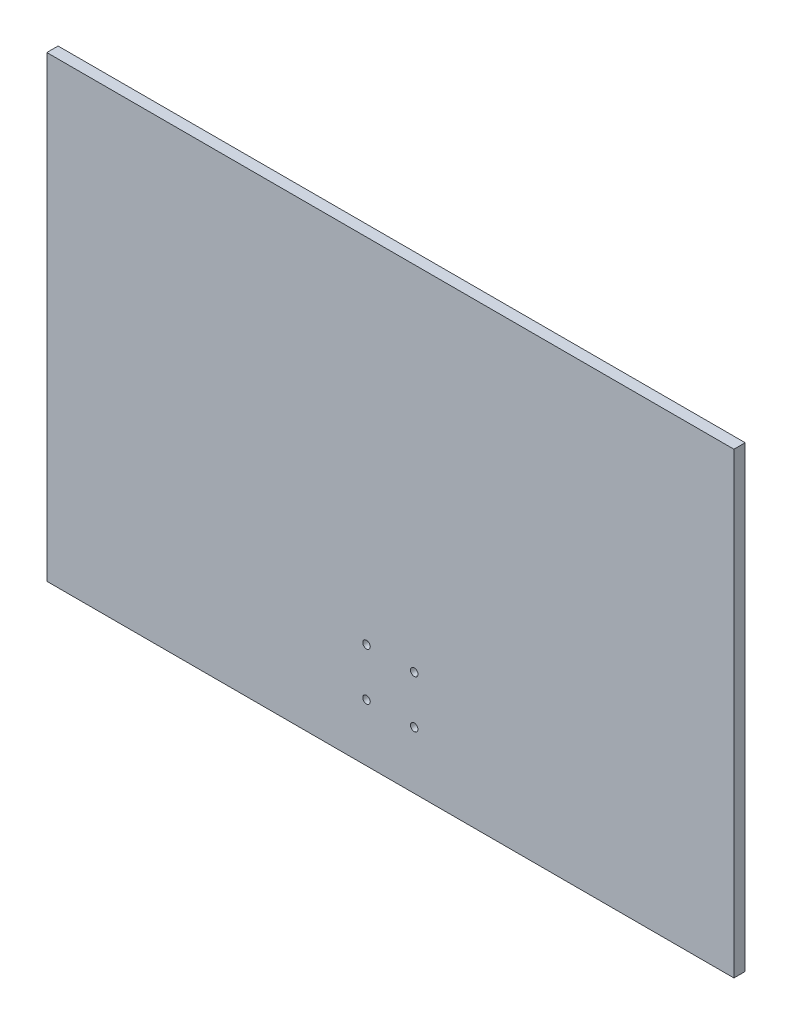
from build123d import *

# Parameters (mm, degrees)
SKETCH1_W           = 30
SKETCH1_H           = 1219
BOSS_EXTRUDE5_DEPTH = 1829
SKETCH6_R           = 10
CUT_EXTRUDE1_DEPTH  = 2199.204267124


with BuildPart() as part:
    # Sketch1 → Boss-Extrude5 (new body)
    with BuildSketch(Plane(origin=(0, 0, 0), x_dir=(0, 0, -1), z_dir=(1, 0, 0))):
        with Locations((-15, 609.5)):
            Rectangle(SKETCH1_W, SKETCH1_H)
    extrude(amount=-BOSS_EXTRUDE5_DEPTH)

    # Sketch6 → Cut-Extrude1 (cut, through all)
    with BuildSketch(Plane.XY.offset(30)):
        with Locations((-978, 279.6)):
            Circle(SKETCH6_R)
        with Locations((-851, 279.6)):
            Circle(SKETCH6_R)
        with Locations(Location((-851, 152.6, 0), (0, 0, 180))):
            Circle(SKETCH6_R)
        with Locations(Location((-978, 152.6, 0), (0, 0, 180))):
            Circle(SKETCH6_R)
    extrude(amount=-CUT_EXTRUDE1_DEPTH, mode=Mode.SUBTRACT)


solid = part.part
